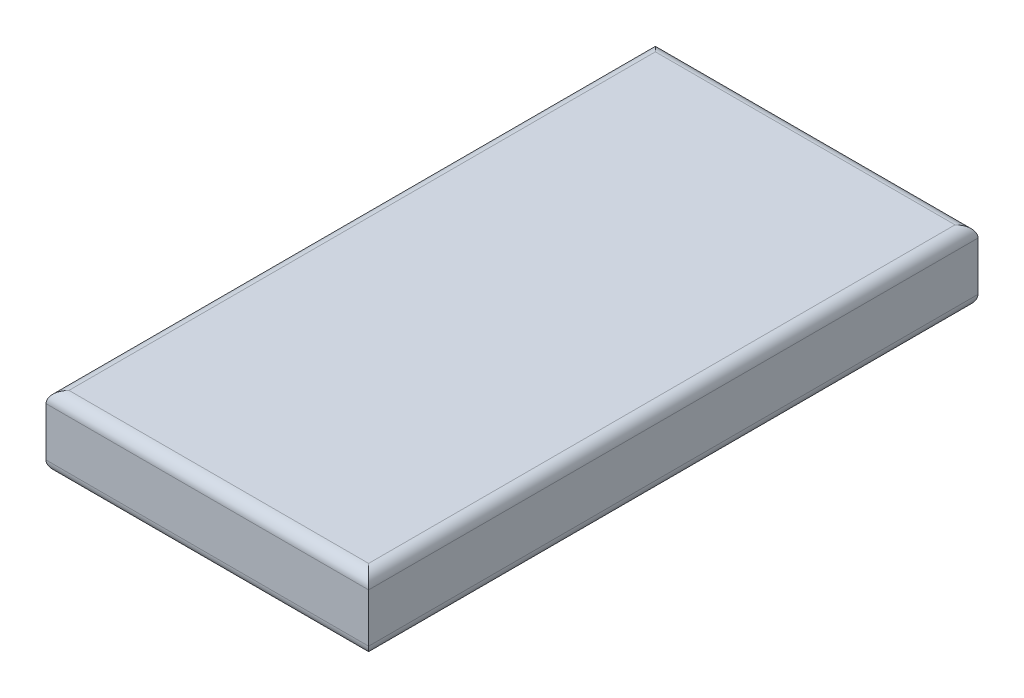
from build123d import *

# Parameters (mm, degrees)
SKETCH1_W           = 14.2875
SKETCH1_H           = 26.9875
BOSS_EXTRUDE1_DEPTH = 3.175
FILLET1_R           = 0.508


with BuildPart() as part:
    # Sketch1 → Boss-Extrude1 (new body)
    with BuildSketch(Plane(origin=(0, 0, 0), x_dir=(1, 0, 0), z_dir=(0, 1, 0))):
        with Locations((-7.14375, 13.49375)):
            Rectangle(SKETCH1_W, SKETCH1_H)
    extrude(amount=BOSS_EXTRUDE1_DEPTH)

    # Fillet1
    fillet1_edges = [part.edges().sort_by_distance(p)[0] for p in [
        (-14.2875, 3.175, -13.49375),
        (-7.14375, 3.175, 0),
        (0, 3.175, -13.49375),
        (-7.14375, 0, 0),
        (-14.2875, 0, -13.49375),
        (-7.14375, 0, -26.9875),
        (0, 0, -13.49375),
        (-7.14375, 3.175, -26.9875),
    ]]
    fillet(fillet1_edges, radius=FILLET1_R)


solid = part.part
